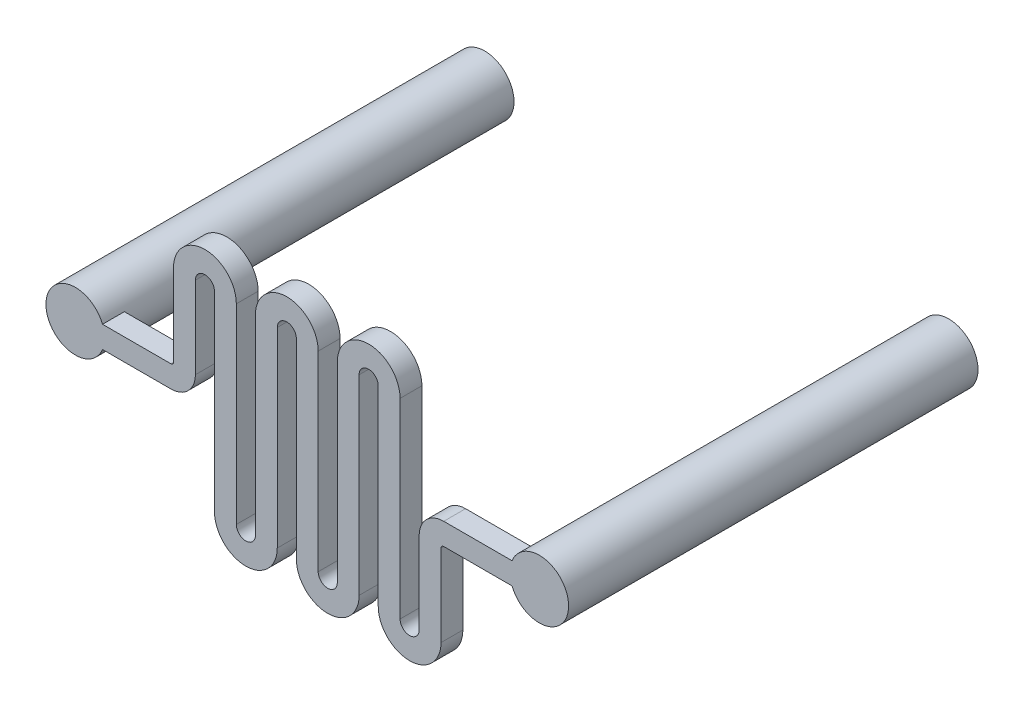
from build123d import *

# Parameters (mm, degrees)
BOSS_EXTRUDE1_DEPTH = 1.6
SKETCH3_W           = 2.15
SKETCH3_H           = 30
SKETCH4_W           = 2.15
SKETCH4_H           = 30
SKETCH5_R           = 1.5
CUT_EXTRUDE1_DEPTH  = 28


with BuildPart() as part:
    # Sketch2 → Boss-Extrude1 (new body)
    with BuildSketch(Plane.XY):
        with BuildLine():
            Line((-20.5, -0.8), (-13.5, -0.8))
            ThreePointArc((-13.5, -0.8), (-12.227207794, -0.272792206), (-11.7, 1))
            Line((-11.7, 1), (-11.7, 7))
            ThreePointArc((-11.7, 7), (-11, 7.7), (-10.3, 7))
            Line((-10.3, 7), (-10.3, 0))
            Line((-10.3, 0), (-10.3, -7))
            ThreePointArc((-10.3, -7), (-8, -9.3), (-5.7, -7))
            Line((-5.7, -7), (-5.7, 0))
            Line((-5.7, 0), (-5.7, 7))
            ThreePointArc((-5.7, 7), (-5, 7.7), (-4.3, 7))
            Line((-4.3, 7), (-4.3, 0))
            Line((-4.3, 0), (-4.3, -7))
            ThreePointArc((-4.3, -7), (-2, -9.3), (0.3, -7))
            Line((0.3, -7), (0.3, 0))
            Line((0.3, 0), (0.3, 7))
            ThreePointArc((0.3, 7), (1, 7.7), (1.7, 7))
            Line((1.7, 7), (1.7, 0))
            Line((1.7, 0), (1.7, -7))
            ThreePointArc((1.7, -7), (4, -9.3), (6.3, -7))
            Line((6.3, -7), (6.3, -1))
            ThreePointArc((6.3, -1), (6.358578644, -0.858578644), (6.5, -0.8))
            Line((6.5, -0.8), (13.5, -0.8))
            ThreePointArc((13.5, -0.8), (14.3, 0), (13.5, 0.8))
            Line((13.5, 0.8), (6.5, 0.8))
            ThreePointArc((6.5, 0.8), (5.227207794, 0.272792206), (4.7, -1))
            Line((4.7, -1), (4.7, -7))
            ThreePointArc((4.7, -7), (4, -7.7), (3.3, -7))
            Line((3.3, -7), (3.3, 0))
            Line((3.3, 0), (3.3, 7))
            ThreePointArc((3.3, 7), (1, 9.3), (-1.3, 7))
            Line((-1.3, 7), (-1.3, 0))
            Line((-1.3, 0), (-1.3, -7))
            ThreePointArc((-1.3, -7), (-2, -7.7), (-2.7, -7))
            Line((-2.7, -7), (-2.7, 0))
            Line((-2.7, 0), (-2.7, 7))
            ThreePointArc((-2.7, 7), (-5, 9.3), (-7.3, 7))
            Line((-7.3, 7), (-7.3, 0))
            Line((-7.3, 0), (-7.3, -7))
            ThreePointArc((-7.3, -7), (-8, -7.7), (-8.7, -7))
            Line((-8.7, -7), (-8.7, 0))
            Line((-8.7, 0), (-8.7, 7))
            ThreePointArc((-8.7, 7), (-11, 9.3), (-13.3, 7))
            Line((-13.3, 7), (-13.3, 1))
            ThreePointArc((-13.3, 1), (-13.358578644, 0.858578644), (-13.5, 0.8))
            Line((-13.5, 0.8), (-20.5, 0.8))
            ThreePointArc((-20.5, 0.8), (-21.3, 0), (-20.5, -0.8))
        make_face()
    extrude(amount=BOSS_EXTRUDE1_DEPTH)

    # Sketch3 → Revolve1 (revolve)
    with BuildSketch(Plane(origin=(0, 0, 0), x_dir=(1, 0, 0), z_dir=(0, 1, 0)), mode=Mode.PRIVATE) as revolve1_sk:
        with Locations((-21.575, 13.4)):
            Rectangle(SKETCH3_W, SKETCH3_H)
    revolve(revolve1_sk.sketch.rotate(Axis((-20.5, 0, 1.6), (0, 0, -1)), 180), axis=Axis((-20.5, 0, 1.6), (0, 0, -1)))

    # Sketch4 → Revolve2 (revolve)
    with BuildSketch(Plane(origin=(0, 0, 0), x_dir=(1, 0, 0), z_dir=(0, 1, 0))):
        with Locations((14.575, 13.4)):
            Rectangle(SKETCH4_W, SKETCH4_H)
    revolve(axis=Axis((13.5, 0, 1.6), (0, 0, -1)))

    # Sketch5 → Cut-Extrude1 (cut)
    with BuildSketch(Plane(origin=(0, 0, -28.4), x_dir=(-1, 0, 0), z_dir=(0, 0, -1))):
        with Locations((20.5, 0)):
            Circle(SKETCH5_R)
        with Locations((-13.5, 0)):
            Circle(SKETCH5_R)
    extrude(amount=-CUT_EXTRUDE1_DEPTH, mode=Mode.SUBTRACT)


solid = part.part
